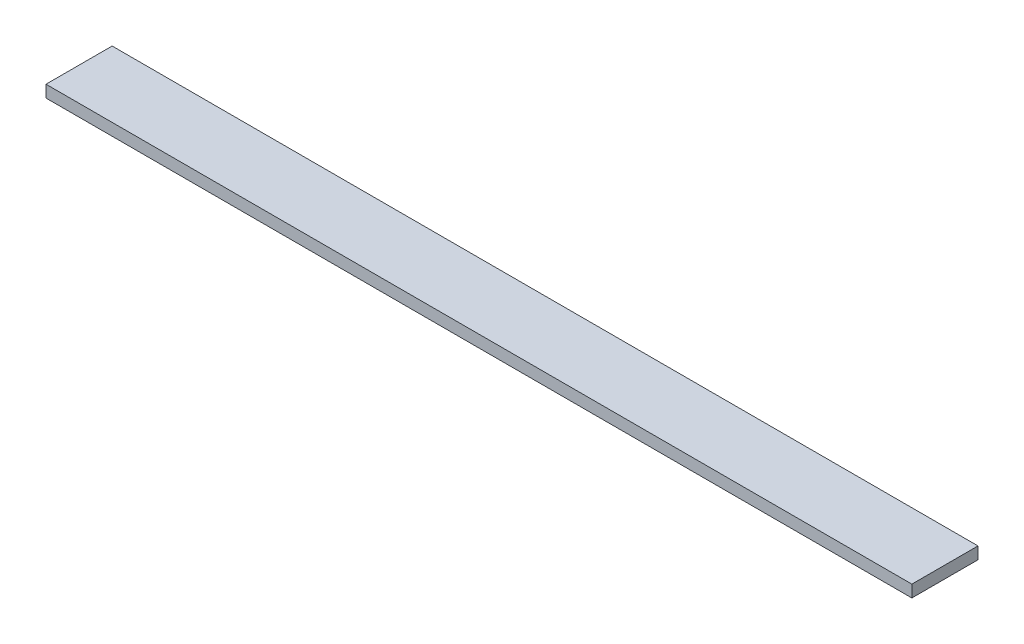
from build123d import *

# Parameters (mm, degrees)
SKETCH1_W           = 1828.8
SKETCH1_H           = 139.7
BOSS_EXTRUDE1_DEPTH = 25.4


with BuildPart() as part:
    # Sketch1 → Boss-Extrude1 (new body)
    with BuildSketch(Plane(origin=(0, 0, 0), x_dir=(1, 0, 0), z_dir=(0, 1, 0))):
        Rectangle(SKETCH1_W, SKETCH1_H)
    extrude(amount=BOSS_EXTRUDE1_DEPTH)


solid = part.part
